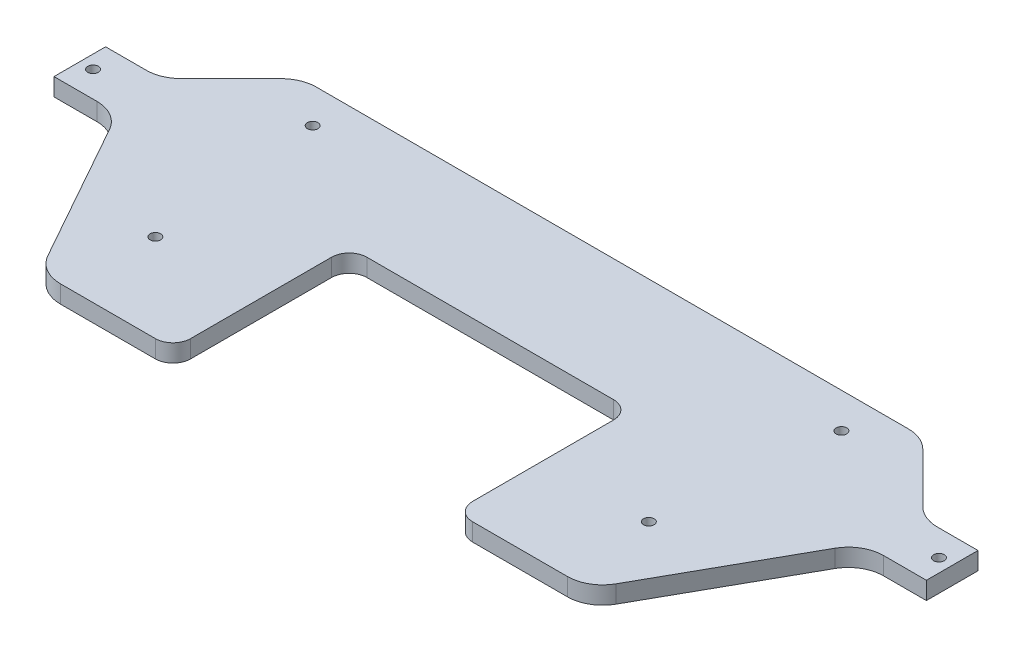
from build123d import *

# Parameters (mm, degrees)
SALIENTE_EXTRUIR1_DEPTH = 5
REDONDEO1_R             = 10
CROQUIS2_R              = 1.5
CORTAR_EXTRUIR1_DEPTH   = 135.669558943
CROQUIS4_W              = 80
CROQUIS4_H              = 50
CORTAR_EXTRUIR2_DEPTH   = 135.669558943
REDONDEO2_R             = 5
CROQUIS5_W              = 4
CROQUIS5_H              = 14.636342218
CORTAR_EXTRUIR3_DEPTH   = 135.669558943


with BuildPart() as part:
    # Croquis1 → Saliente-Extruir1 (new body)
    with BuildSketch(Plane(origin=(0, 0, 0), x_dir=(1, 0, 0), z_dir=(0, 1, 0))):
        Polygon((-88.1, 42.318171109), (88.1, 42.318171109), (108.1, 22.318171109), (127.75, 22.318171109), (127.75, 7.681828891), (105.75, 7.681828891), (77.75, -42.318171109), (-77.75, -42.318171109), (-105.75, 7.681828891), (-127.75, 7.681828891), (-127.75, 22.318171109), (-108.1, 22.318171109), align=None)
    extrude(amount=SALIENTE_EXTRUIR1_DEPTH)

    # Redondeo1
    redondeo1_edges = [part.edges().sort_by_distance(p)[0] for p in [
        (-88.1, 2.5, -42.318171109),
        (88.1, 2.5, -42.318171109),
        (108.1, 2.5, -22.318171109),
        (105.75, 2.5, -7.681828891),
        (77.75, 2.5, 42.318171109),
        (-77.75, 2.5, 42.318171109),
        (-105.75, 2.5, -7.681828891),
        (-108.1, 2.5, -22.318171109),
    ]]
    fillet(redondeo1_edges, radius=REDONDEO1_R)

    # Croquis2 → Cortar-Extruir1 (cut, through all)
    with BuildSketch(Plane(origin=(0, 5, 0), x_dir=(1, 0, 0), z_dir=(0, 1, 0))):
        with Locations(Location((70, -17.318171109, 0), (0, 0, 270))):
            Circle(CROQUIS2_R)
        with Locations(Location((-70, -17.318171109, 0), (0, 0, 270))):
            Circle(CROQUIS2_R)
        with Locations(Location((-119.996067812, 15, 0), (0, 0, 270))):
            Circle(CROQUIS2_R)
        with Locations(Location((119.996067812, 15, 0), (0, 0, 270))):
            Circle(CROQUIS2_R)
        with Locations(Location((-75, 32.318171109, 0), (0, 0, 270))):
            Circle(CROQUIS2_R)
        with Locations(Location((75, 32.318171109, 0), (0, 0, 270))):
            Circle(CROQUIS2_R)
        with Locations(Location((-17.5, -17.318171109, 0), (0, 0, 270))):
            Circle(CROQUIS2_R)
        with Locations(Location((17.5, -17.318171109, 0), (0, 0, 270))):
            Circle(CROQUIS2_R)
        with Locations(Location((-17.5, -37.318171109, 0), (0, 0, 270))):
            Circle(CROQUIS2_R)
        with Locations(Location((17.5, -37.318171109, 0), (0, 0, 270))):
            Circle(CROQUIS2_R)
    extrude(amount=-CORTAR_EXTRUIR1_DEPTH, mode=Mode.SUBTRACT)

    # Croquis4 → Cortar-Extruir2 (cut, through all)
    with BuildSketch(Plane(origin=(0, 5, 0), x_dir=(1, 0, 0), z_dir=(0, 1, 0))):
        with Locations((0, -17.318171109)):
            Rectangle(CROQUIS4_W, CROQUIS4_H)
    extrude(amount=-CORTAR_EXTRUIR2_DEPTH, mode=Mode.SUBTRACT)

    # Redondeo2
    redondeo2_edges = [part.edges().sort_by_distance(p)[0] for p in [
        (40, 2.5, 42.318171109),
        (-40, 2.5, 42.318171109),
        (-40, 2.5, -7.681828891),
        (40, 2.5, -7.681828891),
    ]]
    fillet(redondeo2_edges, radius=REDONDEO2_R)

    # Croquis5 → Cortar-Extruir3 (cut, through all)
    with BuildSketch(Plane(origin=(0, 5, 0), x_dir=(1, 0, 0), z_dir=(0, 1, 0))):
        with Locations((-125.75, 15)):
            Rectangle(CROQUIS5_W, CROQUIS5_H)
        with Locations((125.75, 15)):
            Rectangle(CROQUIS5_W, CROQUIS5_H)
    extrude(amount=-CORTAR_EXTRUIR3_DEPTH, mode=Mode.SUBTRACT)


solid = part.part
